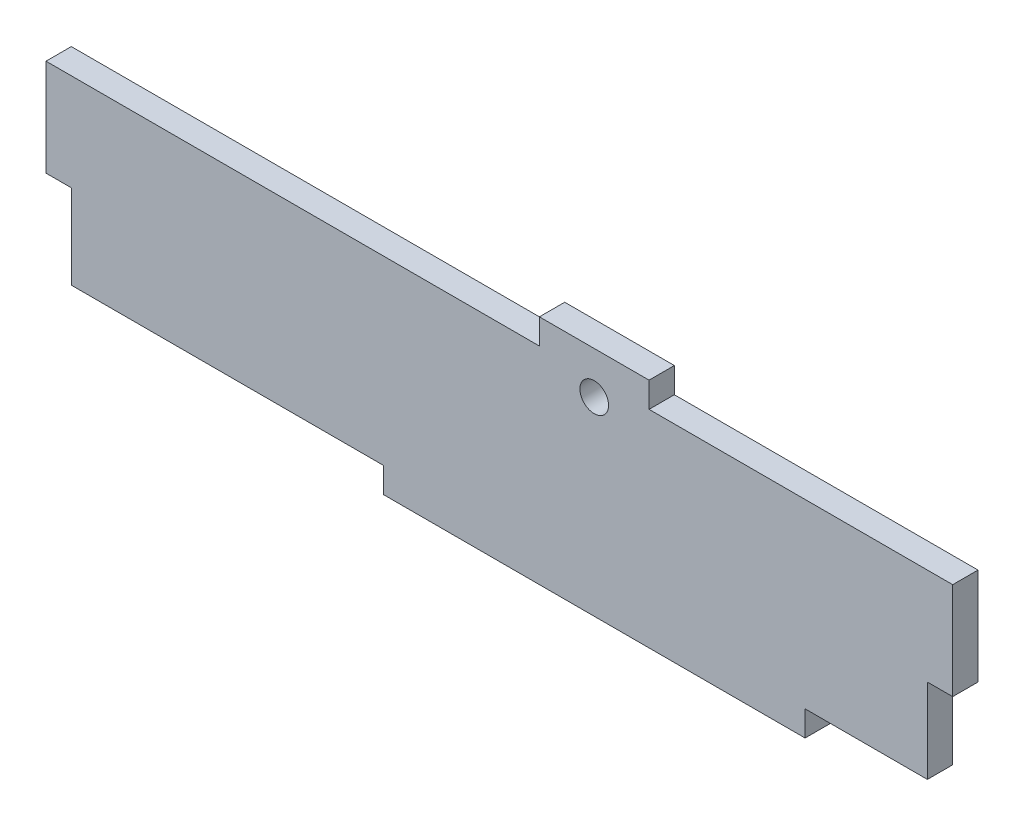
from build123d import *

# Parameters (mm, degrees)
SKETCH1_W              = 215
SKETCH1_H              = 49
BOSS_EXTRUDE1_DEPTH    = 6
CUT_EXTRUDE1_REACH     = 141.058
SKETCH2_W              = 72
SKETCH2_H              = 6
SKETCH2_W_2            = 117
M8X1_25_TAPPED_HOLE1_D = 6.8
CUT_EXTRUDE2_REACH     = 141.058
SKETCH5_W              = 6
SKETCH5_H              = 20
SKETCH6_W              = 100
SKETCH6_H              = 6
BOSS_EXTRUDE2_DEPTH    = 6


with BuildPart() as part:
    # Sketch1 → Boss-Extrude1 (new body)
    with BuildSketch(Plane.XY):
        with Locations((-22.5, 24.5)):
            Rectangle(SKETCH1_W, SKETCH1_H)
    extrude(amount=BOSS_EXTRUDE1_DEPTH)

    # Sketch2 → Cut-Extrude1 (cut, up to next)
    with BuildSketch(Plane(origin=(0, 0, 0), x_dir=(-1, 0, 0), z_dir=(0, 0, -1)), mode=Mode.PRIVATE) as cut_extrude1_sk1:
        with Locations((-49, 46)):
            Rectangle(SKETCH2_W, SKETCH2_H)
    cut_extrude1_tool1 = extrude(cut_extrude1_sk1.sketch, amount=-CUT_EXTRUDE1_REACH, mode=Mode.PRIVATE) & part.part
    # Sketch2 → Cut-Extrude1 (cut, up to next)
    with BuildSketch(Plane(origin=(0, 0, 0), x_dir=(-1, 0, 0), z_dir=(0, 0, -1)), mode=Mode.PRIVATE) as cut_extrude1_sk2:
        with Locations((71.5, 46)):
            Rectangle(SKETCH2_W_2, SKETCH2_H)
    cut_extrude1_tool2 = extrude(cut_extrude1_sk2.sketch, amount=-CUT_EXTRUDE1_REACH, mode=Mode.PRIVATE) & part.part
    add(cut_extrude1_tool1.solids().sort_by_distance((49, 46, 0))[0], mode=Mode.SUBTRACT)
    add(cut_extrude1_tool2.solids().sort_by_distance((-71.5, 46, 0))[0], mode=Mode.SUBTRACT)

    # M8x1.25 Tapped Hole1 (through all)
    with Locations(Plane(origin=(0, 0, 0), x_dir=(-1, 0, 0), z_dir=(0, 0, -1))):
        with Locations((0, 39)):
            Hole(M8X1_25_TAPPED_HOLE1_D / 2)

    # Sketch5 → Cut-Extrude2 (cut, up to next)
    with BuildSketch(Plane(origin=(0, 0, 0), x_dir=(-1, 0, 0), z_dir=(0, 0, -1)), mode=Mode.PRIVATE) as cut_extrude2_sk1:
        with Locations((-82, 10)):
            Rectangle(SKETCH5_W, SKETCH5_H)
    cut_extrude2_tool1 = extrude(cut_extrude2_sk1.sketch, amount=-CUT_EXTRUDE2_REACH, mode=Mode.PRIVATE) & part.part
    # Sketch5 → Cut-Extrude2 (cut, up to next)
    with BuildSketch(Plane(origin=(0, 0, 0), x_dir=(-1, 0, 0), z_dir=(0, 0, -1)), mode=Mode.PRIVATE) as cut_extrude2_sk2:
        with Locations((127, 10)):
            Rectangle(SKETCH5_W, SKETCH5_H)
    cut_extrude2_tool2 = extrude(cut_extrude2_sk2.sketch, amount=-CUT_EXTRUDE2_REACH, mode=Mode.PRIVATE) & part.part
    add(cut_extrude2_tool1.solids().sort_by_distance((82, 10, 0))[0], mode=Mode.SUBTRACT)
    add(cut_extrude2_tool2.solids().sort_by_distance((-127, 10, 0))[0], mode=Mode.SUBTRACT)

    # Sketch6 → Boss-Extrude2 (add)
    with BuildSketch(Plane(origin=(0, 0, 0), x_dir=(-1, 0, 0), z_dir=(0, 0, -1))):
        with Locations((0, -3)):
            Rectangle(SKETCH6_W, SKETCH6_H)
    extrude(amount=-BOSS_EXTRUDE2_DEPTH)


solid = part.part
